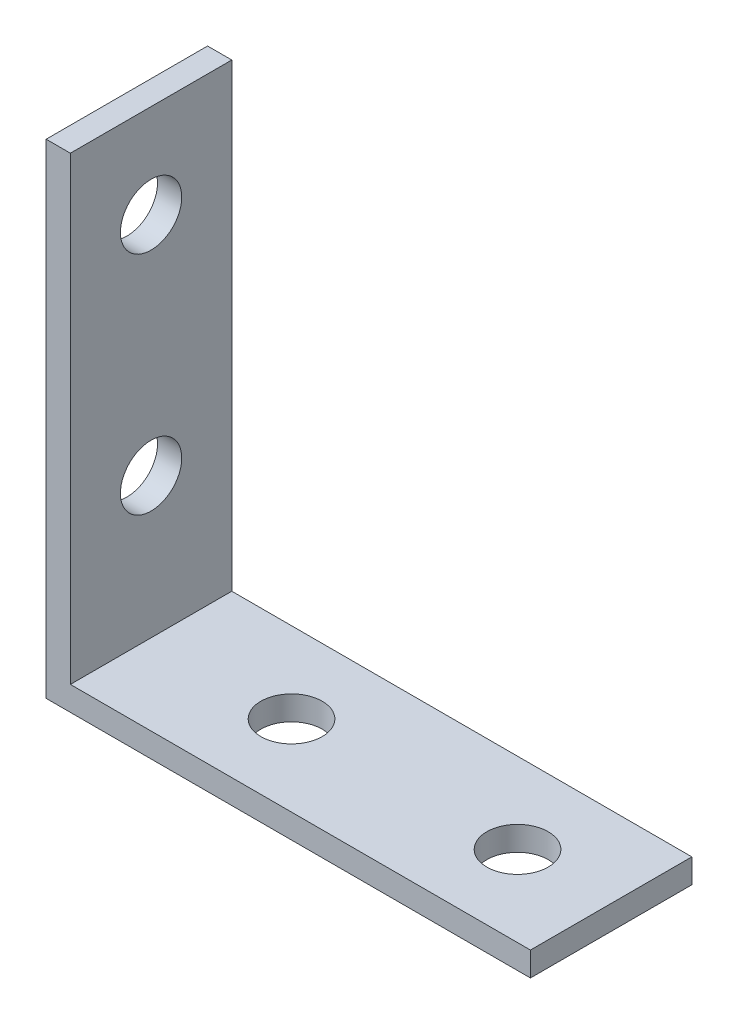
from build123d import *

# Parameters (mm, degrees)
BOSS_EXTRUDE1_DEPTH = 12.7
SKETCH2_R           = 2.413
CUT_EXTRUDE1_DEPTH  = 55.064572735


with BuildPart() as part:
    # Sketch1 → Boss-Extrude1 (new body)
    with BuildSketch(Plane.XY):
        Polygon((0, 0), (0, 38.1), (1.905, 38.1), (1.905, 1.905), (38.1, 1.905), (38.1, 0), align=None)
    extrude(amount=BOSS_EXTRUDE1_DEPTH)

    # Sketch2 → Cut-Extrude1 (cut, through all)
    with BuildSketch(Plane(origin=(1.905, 0, 0), x_dir=(0, 0, -1), z_dir=(1, 0, 0))):
        with Locations(Location((-6.35, 30.734, 0), (0, 0, 90))):
            Circle(SKETCH2_R)
        with Locations(Location((-6.35, 12.954, 0), (0, 0, 90))):
            Circle(SKETCH2_R)
    cut_extrude1 = extrude(amount=-CUT_EXTRUDE1_DEPTH, mode=Mode.SUBTRACT)

    # Mirror1: Cut-Extrude1 across plane
    add(cut_extrude1.mirror(Plane(origin=(0, 0, 0), x_dir=(0, 0, 1), z_dir=(-0.7071067811865471, 0.7071067811865479, 0))), mode=Mode.SUBTRACT)


solid = part.part
